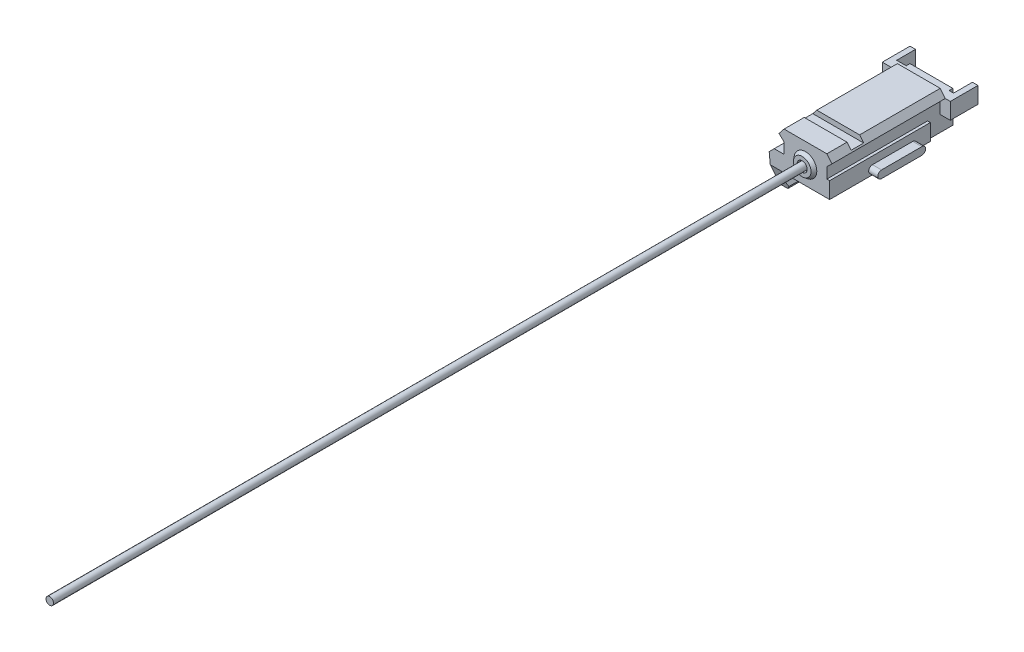
from build123d import *

# Parameters (mm, degrees)
BOSS_EXTRU_1_DEPTH                                 = 40
ENL_V_MAT_EXTRU_1_DEPTH                            = 43.650205158
ENL_V_MAT_EXTRU_1_DEPTH_BACK                       = 43.650205158
ENL_V_MAT_EXTRU_3_DEPTH                            = 40
CHAMBRAGE_POUR_VIS_T_TE_HEXAGONALE_M31_D           = 3.4
CHAMBRAGE_POUR_VIS_T_TE_HEXAGONALE_M31_CBORE_D     = 4.2
CHAMBRAGE_POUR_VIS_T_TE_HEXAGONALE_M31_CBORE_DEPTH = 3
ESQUISSE6_W                                        = 7.050171065
ESQUISSE6_H                                        = 7.359112957
ENL_V_MAT_EXTRU_4_DEPTH                            = 10
BOSS_EXTRU_2_DEPTH                                 = 50
ESQUISSE9_W                                        = 5
ESQUISSE9_H                                        = 2.5
ENL_V_MAT_EXTRU_5_DEPTH                            = 51.216531143
ESQUISSE11_W                                       = 2
ESQUISSE11_H                                       = 5
ESQUISSE11_W_2                                     = 2.243048
ENL_V_MAT_EXTRU_6_DEPTH                            = 10
ESQUISSE13_W                                       = 10
ESQUISSE13_H                                       = 6.5
ENL_V_MAT_EXTRU_7_DEPTH                            = 6.5
ESQUISSE14_W                                       = 10
ESQUISSE14_H                                       = 6.5
ENL_V_MAT_EXTRU_8_DEPTH                            = 6.5
BOSS_EXTRU_3_DEPTH                                 = 6.5
ESQUISSE15_W                                       = 21
ESQUISSE15_H                                       = 2
ENL_V_MAT_EXTRU_9_DEPTH                            = 5
BOSS_EXTRU_4_DEPTH                                 = 3.6
ESQUISSE17_R                                       = 1.5
BOSS_EXTRU_5_DEPTH                                 = 300


with BuildPart() as part:
    # Esquisse1 → Boss.-Extru.1 (new body)
    with BuildSketch(Plane.XY):
        Polygon((0, -2), (2, 0), (4.8, 0), (4.8, -10.6), (4.43, -11), (5.42, -12.5), (4.43, -14), (1.23, -14), align=None)
    extrude(amount=BOSS_EXTRU_1_DEPTH)

    # Esquisse2 → Enlèv. mat.-Extru.1 (cut, two sides: drawn at the far end of the back side and taken through both)
    with BuildSketch(Plane(origin=(4.8, 0, 0), x_dir=(0, 0, -1), z_dir=(1, 0, 0)).offset(-ENL_V_MAT_EXTRU_1_DEPTH_BACK)):
        Polygon((-37, -14), (-40, -6.3), (-40, -14), align=None)
    extrude(amount=ENL_V_MAT_EXTRU_1_DEPTH + ENL_V_MAT_EXTRU_1_DEPTH_BACK, mode=Mode.SUBTRACT)

    # Esquisse3 → Enlèv. mat.-Extru.3 (cut)
    with BuildSketch(Plane(origin=(0, -6.5, 0), x_dir=(-1, 0, 0), z_dir=(0, 1, 0))):
        Polygon((-5.706792822, 0), (-1.3, 0), (-4.8, 3.75), (-5.706792822, 3.75), align=None)
    extrude(amount=-ENL_V_MAT_EXTRU_3_DEPTH, mode=Mode.SUBTRACT)

    # Chambrage pour vis à tête hexagonale M31 (through all)
    with Locations(Plane(origin=(-0.2, 2.258699511, 74.572212386), x_dir=(0, 0, -1), z_dir=(-1, 0, 0))):
        with Locations((55.572212386, 11.258699511), (45.572212386, 11.258699511)):
            CounterBoreHole(CHAMBRAGE_POUR_VIS_T_TE_HEXAGONALE_M31_D / 2, CHAMBRAGE_POUR_VIS_T_TE_HEXAGONALE_M31_CBORE_D / 2, CHAMBRAGE_POUR_VIS_T_TE_HEXAGONALE_M31_CBORE_DEPTH)

    # Esquisse6 → Enlèv. mat.-Extru.4 (cut)
    with BuildSketch(Plane(origin=(0.694774347, 0, -0.648456057), x_dir=(-0.6823182503600115, 0, -0.7310552682428687), z_dir=(0.7310552682428687, 0, -0.6823182503600115))):
        with Locations((-6.596251813, -11.630248497)):
            Rectangle(ESQUISSE6_W, ESQUISSE6_H)
    extrude(amount=ENL_V_MAT_EXTRU_4_DEPTH, mode=Mode.SUBTRACT)

    # Esquisse7 → Boss.-Extru.2 (add)
    with BuildSketch(Plane.XY.offset(40)):
        Polygon((4.8, -6.5), (24, -6.5), (24, 0), (22.9, 0), (22.9, 4.3), (24.9, 6.2), (22.9, 8.7), (5.9, 8.7), (3.9, 6.2), (5.9, 4.3), (5.9, 0), (4.8, 0), align=None)
    extrude(amount=-BOSS_EXTRU_2_DEPTH)

    # Esquisse8 → Révolution1 (revolve)
    with BuildSketch(Plane(origin=(14.4, 0, 0), x_dir=(0, 0, -1), z_dir=(1, 0, 0))):
        Polygon((-40, 5.2), (-41.3, 4.2), (-41.3, 2.7), (-40, 2.7), align=None)
    revolve(axis=Axis((14.4, 0.7, 31.308149913), (0, 0, 1)))

    # Esquisse9 → Enlèv. mat.-Extru.5 (cut, through all)
    with BuildSketch(Plane(origin=(0, 0, 0), x_dir=(0, 0, -1), z_dir=(1, 0, 0))):
        with Locations((7.5, 7.45)):
            Rectangle(ESQUISSE9_W, ESQUISSE9_H)
    extrude(amount=ENL_V_MAT_EXTRU_5_DEPTH, mode=Mode.SUBTRACT)

    # Esquisse11 → Enlèv. mat.-Extru.6 (cut)
    with BuildSketch(Plane(origin=(0, 0, 0), x_dir=(1, 0, 0), z_dir=(0, 1, 0))):
        with Locations((23.9, 7.5)):
            Rectangle(ESQUISSE11_W, ESQUISSE11_H)
        with Locations((4.778476, 7.5)):
            Rectangle(ESQUISSE11_W_2, ESQUISSE11_H)
    extrude(amount=ENL_V_MAT_EXTRU_6_DEPTH, mode=Mode.SUBTRACT)

    # Esquisse13 → Enlèv. mat.-Extru.7 (cut)
    with BuildSketch(Plane.ZY.offset(-5.9)):
        with Locations((-5, -3.25)):
            Rectangle(ESQUISSE13_W, ESQUISSE13_H)
    extrude(amount=ENL_V_MAT_EXTRU_7_DEPTH, mode=Mode.SUBTRACT)

    # Esquisse14 → Enlèv. mat.-Extru.8 (cut)
    with BuildSketch(Plane(origin=(22.9, 0, 0), x_dir=(0, 0, -1), z_dir=(1, 0, 0))):
        with Locations((5, -3.25)):
            Rectangle(ESQUISSE14_W, ESQUISSE14_H)
    extrude(amount=ENL_V_MAT_EXTRU_8_DEPTH, mode=Mode.SUBTRACT)

    # Esquisse10 → Boss.-Extru.3 (add)
    with BuildSketch(Plane(origin=(0, 6.2, 0), x_dir=(1, 0, 0), z_dir=(0, 1, 0))):
        Polygon((26.9, 5), (-0.1, 5), (-0.1, 16), (2.1, 16), (2.1, 8.5), (24.7, 8.5), (24.7, 16), (26.9, 16), align=None)
    extrude(amount=-BOSS_EXTRU_3_DEPTH)

    # Esquisse15 → Enlèv. mat.-Extru.9 (cut)
    with BuildSketch(Plane.XY.offset(32)):
        with Locations((14.4, 7.7)):
            Rectangle(ESQUISSE15_W, ESQUISSE15_H)
    extrude(amount=-ENL_V_MAT_EXTRU_9_DEPTH, mode=Mode.SUBTRACT)

    # Esquisse16 → Boss.-Extru.4 (add)
    with BuildSketch(Plane(origin=(24, 0, 0), x_dir=(0, 0, -1), z_dir=(1, 0, 0))):
        with BuildLine():
            Line((-7, -6), (-23, -6))
            ThreePointArc((-23, -6), (-24.5, -4.5), (-23, -3))
            Line((-23, -3), (-7, -3))
            ThreePointArc((-7, -3), (-5.5, -4.5), (-7, -6))
        make_face()
    extrude(amount=BOSS_EXTRU_4_DEPTH)

    # Esquisse17 → Boss.-Extru.5 (add)
    with BuildSketch(Plane.XY.offset(40)):
        with Locations((14.4, 0.7)):
            Circle(ESQUISSE17_R)
    extrude(amount=BOSS_EXTRU_5_DEPTH)


solid = part.part
